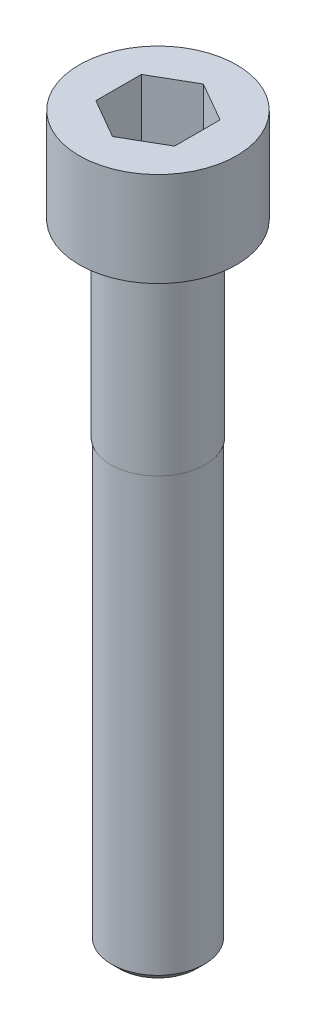
from build123d import *

# Parameters (mm, degrees)
ENL_V_MAT_EXTRU_1_DEPTH = 4


with BuildPart() as part:
    # Esquisse1 → Révolution1 (revolve)
    with BuildSketch(Plane.XY, mode=Mode.PRIVATE) as r_volution1_sk:
        Polygon((0, 0), (-2.45, 0), (-2.95, 0.5), (-2.95, 28), (-3, 28), (-3, 40), (-5, 40), (-5, 46), (0, 46), align=None)
    revolve(r_volution1_sk.sketch.rotate(Axis((0, 46, 0), (0, -1, 0)), 270), axis=Axis((0, 46, 0), (0, -1, 0)))

    # Esquisse2 → Enlèv. mat.-Extru.1 (cut)
    with BuildSketch(Plane(origin=(0, 46, 0), x_dir=(1, 0, 0), z_dir=(0, 1, 0))):
        Polygon((2.5, -1.443375673), (2.5, 1.443375673), (0, 2.886751346), (-2.5, 1.443375673), (-2.5, -1.443375673), (0, -2.886751346), align=None)
    extrude(amount=-ENL_V_MAT_EXTRU_1_DEPTH, mode=Mode.SUBTRACT)


solid = part.part
